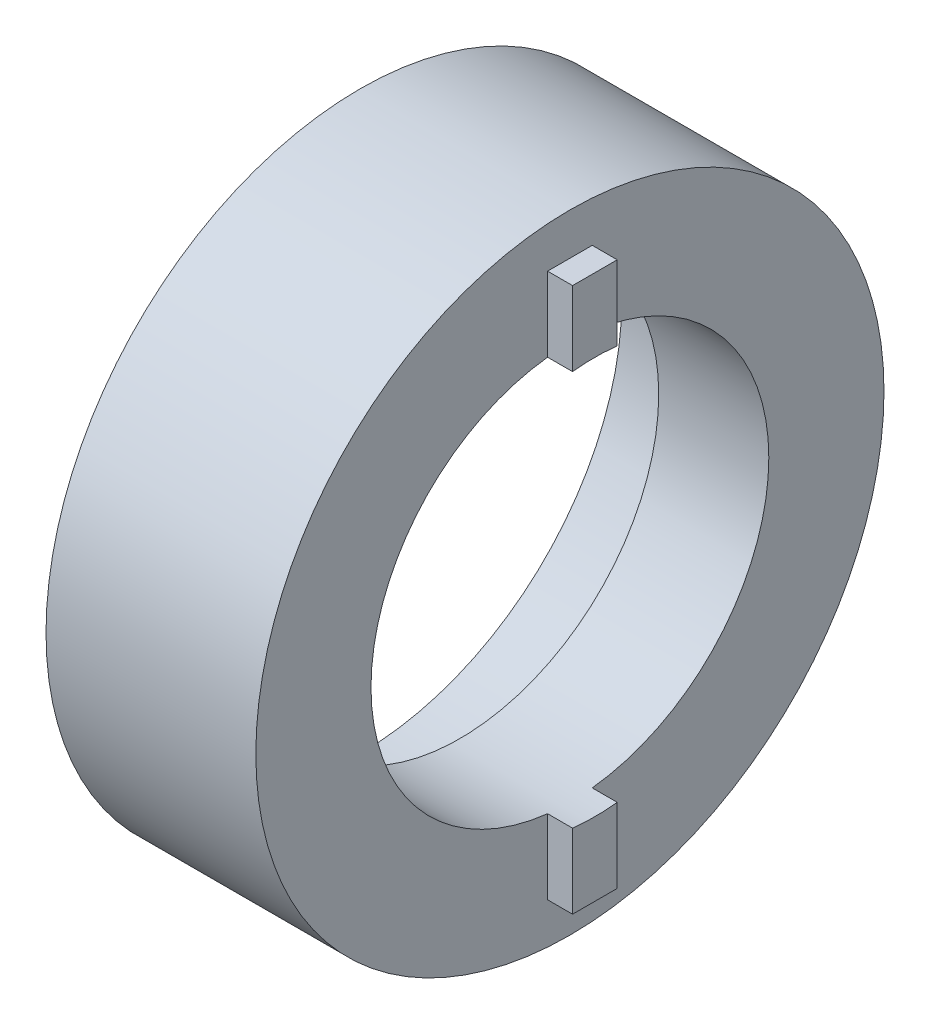
from build123d import *

# Parameters (mm, degrees)
SKETCH13_R           = 30
BOSS_EXTRUDE11_DEPTH = 20.0406
SKETCH14_R           = 25
CUT_EXTRUDE2_DEPTH   = 9.525
SKETCH16_W           = 4.2672
SKETCH16_H           = 52
BOSS_EXTRUDE12_DEPTH = 2.3876
SKETCH15_R           = 19
CUT_EXTRUDE3_DEPTH   = 48.989833874


with BuildPart() as part:
    # Sketch13 → Boss-Extrude11 (new body)
    with BuildSketch(Plane(origin=(0, 0, 0), x_dir=(0, 0, -1), z_dir=(1, 0, 0))):
        with Locations(Location((0, 0, 0), (0, 0, 180))):
            Circle(SKETCH13_R)
    extrude(amount=BOSS_EXTRUDE11_DEPTH)

    # Sketch14 → Cut-Extrude2 (cut)
    with BuildSketch(Plane.ZY):
        Circle(SKETCH14_R)
    extrude(amount=-CUT_EXTRUDE2_DEPTH, mode=Mode.SUBTRACT)

    # Sketch16 → Boss-Extrude12 (add)
    with BuildSketch(Plane(origin=(20.0406, 0, 0), x_dir=(0, 0, -1), z_dir=(1, 0, 0))):
        Rectangle(SKETCH16_W, SKETCH16_H)
    extrude(amount=BOSS_EXTRUDE12_DEPTH)

    # Sketch15 → Cut-Extrude3 (cut, through all)
    with BuildSketch(Plane.ZY):
        Circle(SKETCH15_R)
    extrude(amount=-CUT_EXTRUDE3_DEPTH, mode=Mode.SUBTRACT)


solid = part.part
